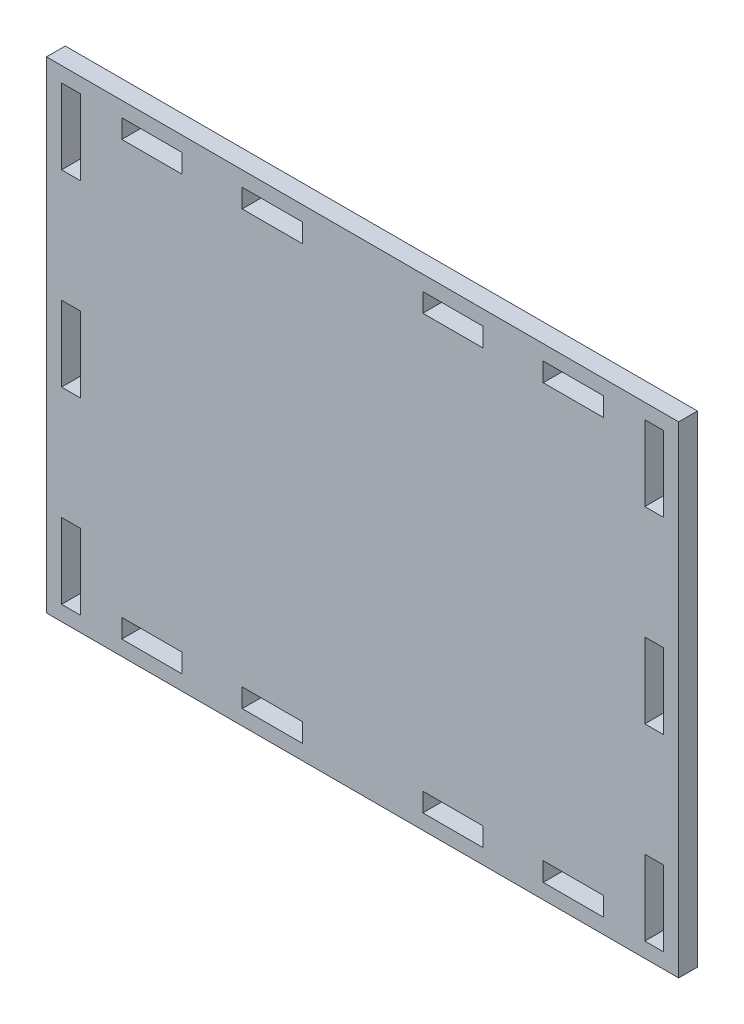
from build123d import *

# Parameters (mm, degrees)
SKETCH1_W           = 84
SKETCH1_H           = 64
SKETCH1_W_2         = 8
SKETCH1_H_2         = 2.5
SKETCH1_W_3         = 2.5
SKETCH1_H_3         = 10
BOSS_EXTRUDE1_DEPTH = 2.5


with BuildPart() as part:
    # Sketch1 → Boss-Extrude1 (new body)
    with BuildSketch(Plane.XY):
        Rectangle(SKETCH1_W, SKETCH1_H)
        with Locations((-12, 28.75)):
            Rectangle(SKETCH1_W_2, SKETCH1_H_2, mode=Mode.SUBTRACT)
        with Locations((-28, 28.75)):
            Rectangle(SKETCH1_W_2, SKETCH1_H_2, mode=Mode.SUBTRACT)
        with Locations((-12, -28.75)):
            Rectangle(SKETCH1_W_2, SKETCH1_H_2, mode=Mode.SUBTRACT)
        with Locations((-28, -28.75)):
            Rectangle(SKETCH1_W_2, SKETCH1_H_2, mode=Mode.SUBTRACT)
        with Locations((-38.75, 0)):
            Rectangle(SKETCH1_W_3, SKETCH1_H_3, mode=Mode.SUBTRACT)
        with Locations((-38.75, 25)):
            Rectangle(SKETCH1_W_3, SKETCH1_H_3, mode=Mode.SUBTRACT)
        with Locations((-38.75, -25)):
            Rectangle(SKETCH1_W_3, SKETCH1_H_3, mode=Mode.SUBTRACT)
        with Locations((12, 28.75)):
            Rectangle(SKETCH1_W_2, SKETCH1_H_2, mode=Mode.SUBTRACT)
        with Locations((28, 28.75)):
            Rectangle(SKETCH1_W_2, SKETCH1_H_2, mode=Mode.SUBTRACT)
        with Locations((38.75, 25)):
            Rectangle(SKETCH1_W_3, SKETCH1_H_3, mode=Mode.SUBTRACT)
        with Locations((38.75, 0)):
            Rectangle(SKETCH1_W_3, SKETCH1_H_3, mode=Mode.SUBTRACT)
        with Locations((28, -28.75)):
            Rectangle(SKETCH1_W_2, SKETCH1_H_2, mode=Mode.SUBTRACT)
        with Locations((12, -28.75)):
            Rectangle(SKETCH1_W_2, SKETCH1_H_2, mode=Mode.SUBTRACT)
        with Locations((38.75, -25)):
            Rectangle(SKETCH1_W_3, SKETCH1_H_3, mode=Mode.SUBTRACT)
    extrude(amount=BOSS_EXTRUDE1_DEPTH)


solid = part.part
